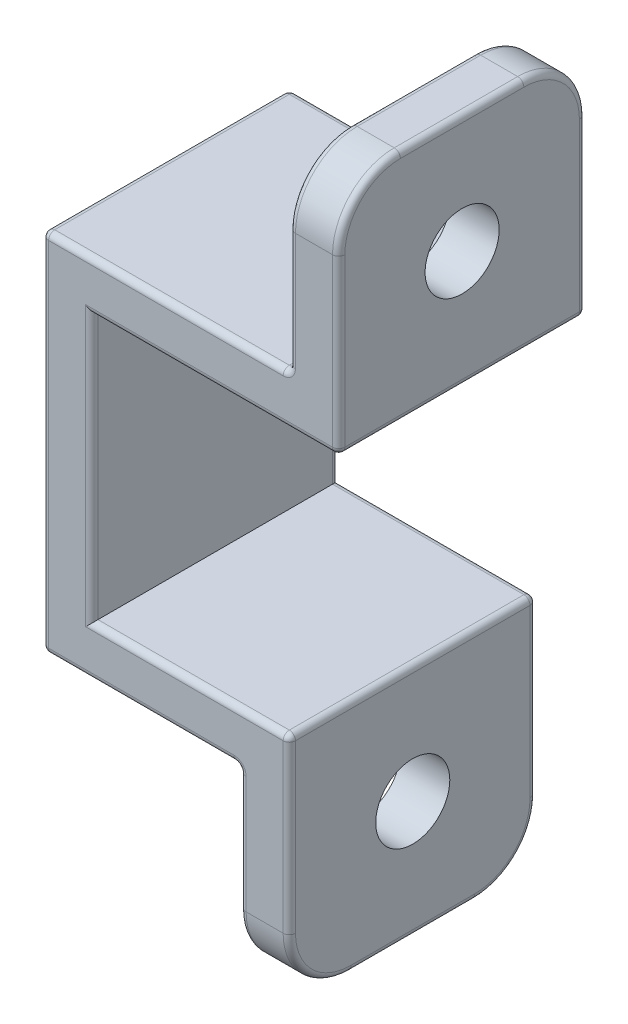
from build123d import *

# Parameters (mm, degrees)
SKETCH2_W           = 20
SKETCH2_H           = 29.6
BOSS_EXTRUDE1_DEPTH = 4
SKETCH3_W           = 20
SKETCH3_H           = 4
BOSS_EXTRUDE2_DEPTH = 20
SKETCH4_W           = 20
SKETCH4_H           = 4
BOSS_EXTRUDE3_DEPTH = 16
SKETCH5_W           = 4
SKETCH5_H           = 20
BOSS_EXTRUDE4_DEPTH = 15
SKETCH6_W           = 4
SKETCH6_H           = 20
BOSS_EXTRUDE5_DEPTH = 15
FILLET1_R           = 5
FILLET3_R           = 0.5
CUT_EXTRUDE2_REACH  = 41.548
SKETCH9_R           = 3
CUT_EXTRUDE3_REACH  = 39.256
SKETCH10_R          = 3


with BuildPart() as part:
    # Sketch2 → Boss-Extrude1 (new body)
    with BuildSketch(Plane(origin=(0, 0, 0), x_dir=(0, 0, -1), z_dir=(1, 0, 0))):
        Rectangle(SKETCH2_W, SKETCH2_H)
    extrude(amount=BOSS_EXTRUDE1_DEPTH)

    # Sketch3 → Boss-Extrude2 (add)
    with BuildSketch(Plane(origin=(4, 0, 0), x_dir=(0, 0, -1), z_dir=(1, 0, 0))):
        with Locations((0, 12.8)):
            Rectangle(SKETCH3_W, SKETCH3_H)
    extrude(amount=BOSS_EXTRUDE2_DEPTH)

    # Sketch4 → Boss-Extrude3 (add)
    with BuildSketch(Plane(origin=(4, 0, 0), x_dir=(0, 0, -1), z_dir=(1, 0, 0))):
        with Locations((0, -12.8)):
            Rectangle(SKETCH4_W, SKETCH4_H)
    extrude(amount=BOSS_EXTRUDE3_DEPTH)

    # Sketch5 → Boss-Extrude4 (add)
    with BuildSketch(Plane(origin=(0, 14.8, 0), x_dir=(1, 0, 0), z_dir=(0, 1, 0))):
        with Locations((22, 0)):
            Rectangle(SKETCH5_W, SKETCH5_H)
    extrude(amount=BOSS_EXTRUDE4_DEPTH)

    # Sketch6 → Boss-Extrude5 (add)
    with BuildSketch(Plane.XZ.offset(14.8)):
        with Locations((18, 0)):
            Rectangle(SKETCH6_W, SKETCH6_H)
    extrude(amount=BOSS_EXTRUDE5_DEPTH)

    # Fillet1
    fillet1_edges = [part.edges().sort_by_distance(p)[0] for p in [
        (22, 29.8, -10),
        (22, 29.8, 10),
        (18, -29.8, 10),
        (18, -29.8, -10),
    ]]
    fillet(fillet1_edges, radius=FILLET1_R)

    # Fillet3
    fillet3_edges = [part.edges().sort_by_distance(p)[0] for p in [
        (4, 0, 10),
        (14, 10.8, 10),
        (14, 10.8, -10),
        (24, 10.8, 0),
        (24, 17.8, -10),
        (4, 0, -10),
        (12, -10.8, 10),
        (12, -10.8, -10),
        (20, -17.8, 10),
        (20, -10.8, 0),
        (10, 14.8, 10),
        (10, 14.8, -10),
        (20, 14.8, 0),
        (0, -14.8, 0),
        (8, -14.8, -10),
        (8, -14.8, 10),
        (16, -14.8, 0),
        (0, 0, 10),
        (0, 14.8, 0),
        (0, 0, -10),
        (20, -29.8, 0),
        (16, -29.8, 0),
        (16, -19.8, -10),
        (16, -19.8, 10),
        (16, -28.335533906, -8.535533906),
        (16, -28.335533906, 8.535533906),
        (24, 17.8, 10),
        (20, 19.8, 10),
        (20, -17.8, -10),
        (20, -28.335533906, -8.535533906),
        (20, -28.335533906, 8.535533906),
        (20, 19.8, -10),
        (24, 29.8, 0),
        (20, 29.8, 0),
        (20, 28.335533906, 8.535533906),
        (20, 28.335533906, -8.535533906),
        (24, 28.335533906, 8.535533906),
        (24, 28.335533906, -8.535533906),
    ]]
    fillet(fillet3_edges, radius=FILLET3_R)

    # Sketch9 → Cut-Extrude2 (cut, up to next)
    with BuildSketch(Plane(origin=(24, 0, 0), x_dir=(0, 0, -1), z_dir=(1, 0, 0)), mode=Mode.PRIVATE) as cut_extrude2_sk1:
        with Locations((0, 20.3)):
            Circle(SKETCH9_R)
    cut_extrude2_tool1 = extrude(cut_extrude2_sk1.sketch, amount=-CUT_EXTRUDE2_REACH, mode=Mode.PRIVATE) & part.part
    add(cut_extrude2_tool1.solids().sort_by_distance((24, 20.3, 0))[0], mode=Mode.SUBTRACT)

    # Sketch10 → Cut-Extrude3 (cut, up to next)
    with BuildSketch(Plane(origin=(20, 0, 0), x_dir=(0, 0, -1), z_dir=(1, 0, 0)), mode=Mode.PRIVATE) as cut_extrude3_sk1:
        with Locations((0, -20.3)):
            Circle(SKETCH10_R)
    cut_extrude3_tool1 = extrude(cut_extrude3_sk1.sketch, amount=-CUT_EXTRUDE3_REACH, mode=Mode.PRIVATE) & part.part
    add(cut_extrude3_tool1.solids().sort_by_distance((20, -20.3, 0))[0], mode=Mode.SUBTRACT)


solid = part.part
